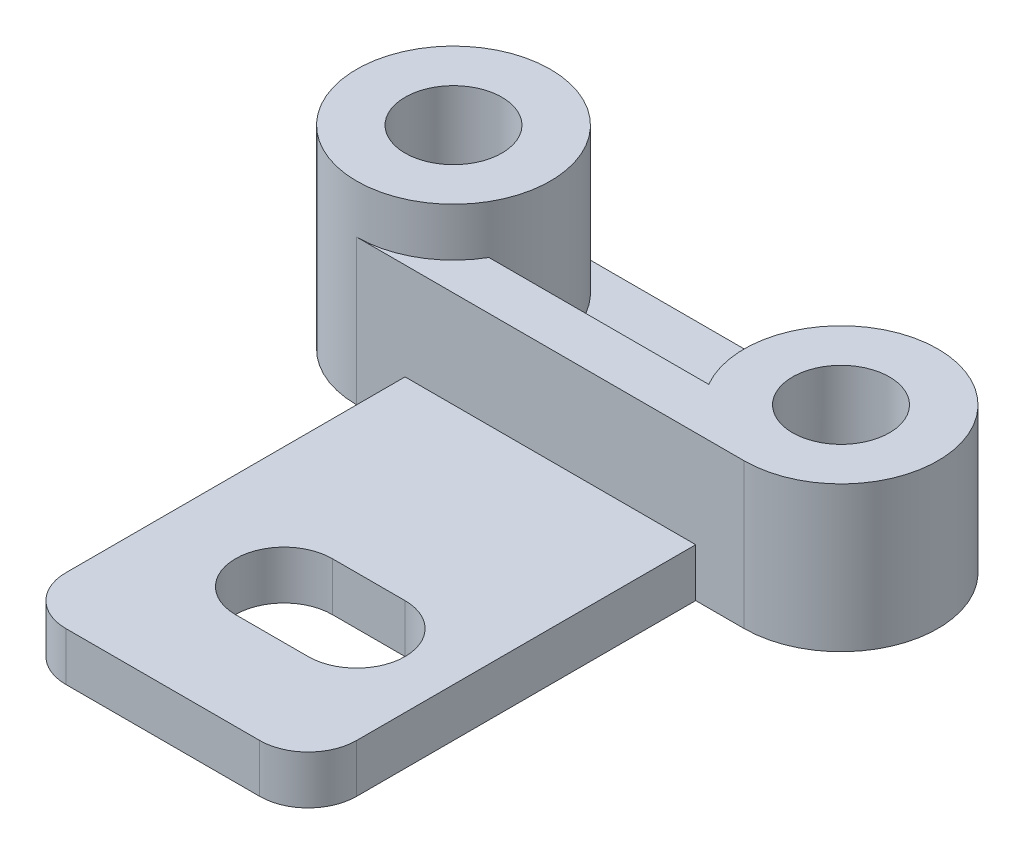
from build123d import *

# Parameters (mm, degrees)
SKETCH1_R           = 20
BOSS_EXTRUDE1_DEPTH = 40
SKETCH2_R           = 10
CUT_EXTRUDE1_DEPTH  = 49.989794856
SKETCH3_R           = 20
BOSS_EXTRUDE2_DEPTH = 30
SKETCH4_R           = 10
CUT_EXTRUDE2_DEPTH  = 107.301458127
SKETCH5_W           = 80
SKETCH5_H           = 10
BOSS_EXTRUDE3_DEPTH = 30
BOSS_EXTRUDE4_DEPTH = 10
BOSS_EXTRUDE5_DEPTH = 10


with BuildPart() as part:
    # Sketch1 → Boss-Extrude1 (new body)
    with BuildSketch(Plane(origin=(0, 0, 0), x_dir=(1, 0, 0), z_dir=(0, 1, 0))):
        with Locations(Location((0, 0, 0), (0, 0, 270))):
            Circle(SKETCH1_R)
    extrude(amount=BOSS_EXTRUDE1_DEPTH)

    # Sketch2 → Cut-Extrude1 (cut, through all)
    with BuildSketch(Plane(origin=(0, 40, 0), x_dir=(1, 0, 0), z_dir=(0, 1, 0))):
        with Locations(Location((0, 0, 0), (0, 0, 270))):
            Circle(SKETCH2_R)
    extrude(amount=-CUT_EXTRUDE1_DEPTH, mode=Mode.SUBTRACT)



with BuildPart() as body_2:
    # Sketch3 → Boss-Extrude2 (new body)
    with BuildSketch(Plane(origin=(0, 0, 0), x_dir=(1, 0, 0), z_dir=(0, 1, 0))):
        with Locations(Location((80, 0, 0), (0, 0, 270))):
            Circle(SKETCH3_R)
    extrude(amount=BOSS_EXTRUDE2_DEPTH)

    # Sketch4 → Cut-Extrude2 (cut, through all)
    with BuildSketch(Plane(origin=(0, 30, 0), x_dir=(1, 0, 0), z_dir=(0, 1, 0))):
        with Locations(Location((80, 0, 0), (0, 0, 270))):
            Circle(SKETCH4_R)
    extrude(amount=-CUT_EXTRUDE2_DEPTH, mode=Mode.SUBTRACT)


with BuildPart() as part_1:
    add(part.part)

    add(body_2.part)  # Boss-Extrude3 merges body 2
    # Sketch5 → Boss-Extrude3 (add)
    with BuildSketch(Plane(origin=(0, 30, 0), x_dir=(1, 0, 0), z_dir=(0, 1, 0))):
        with Locations((40, -15)):
            Rectangle(SKETCH5_W, SKETCH5_H)
    extrude(amount=-BOSS_EXTRUDE3_DEPTH)

    # Sketch6 → Boss-Extrude4 (add)
    with BuildSketch(Plane.XZ):
        with BuildLine():
            Line((0, 20), (80, 20))
            ThreePointArc((80, 20), (100, 0), (80, -20))
            Line((80, -20), (0, -20))
            ThreePointArc((0, -20), (-20, 0), (0, 20))
        make_face()
    extrude(amount=-BOSS_EXTRUDE4_DEPTH)

    # Sketch7 → Boss-Extrude5 (add)
    with BuildSketch(Plane(origin=(0, 0, 0), x_dir=(1, 0, 0), z_dir=(0, 1, 0))):
        with BuildLine():
            Line((10, -20), (70, -20))
            Line((70, -20), (70, -90))
            ThreePointArc((70, -90), (67.071067812, -97.071067812), (60, -100))
            Line((60, -100), (20, -100))
            ThreePointArc((20, -100), (12.928932188, -97.071067812), (10, -90))
            Line((10, -90), (10, -20))
        make_face()
        with BuildLine():
            Line((35, -60), (50, -60))
            ThreePointArc((50, -60), (60, -70), (50, -80))
            Line((50, -80), (35, -80))
            ThreePointArc((35, -80), (25, -70), (35, -60))
        make_face(mode=Mode.SUBTRACT)
    extrude(amount=BOSS_EXTRUDE5_DEPTH)


solid = part_1.part
